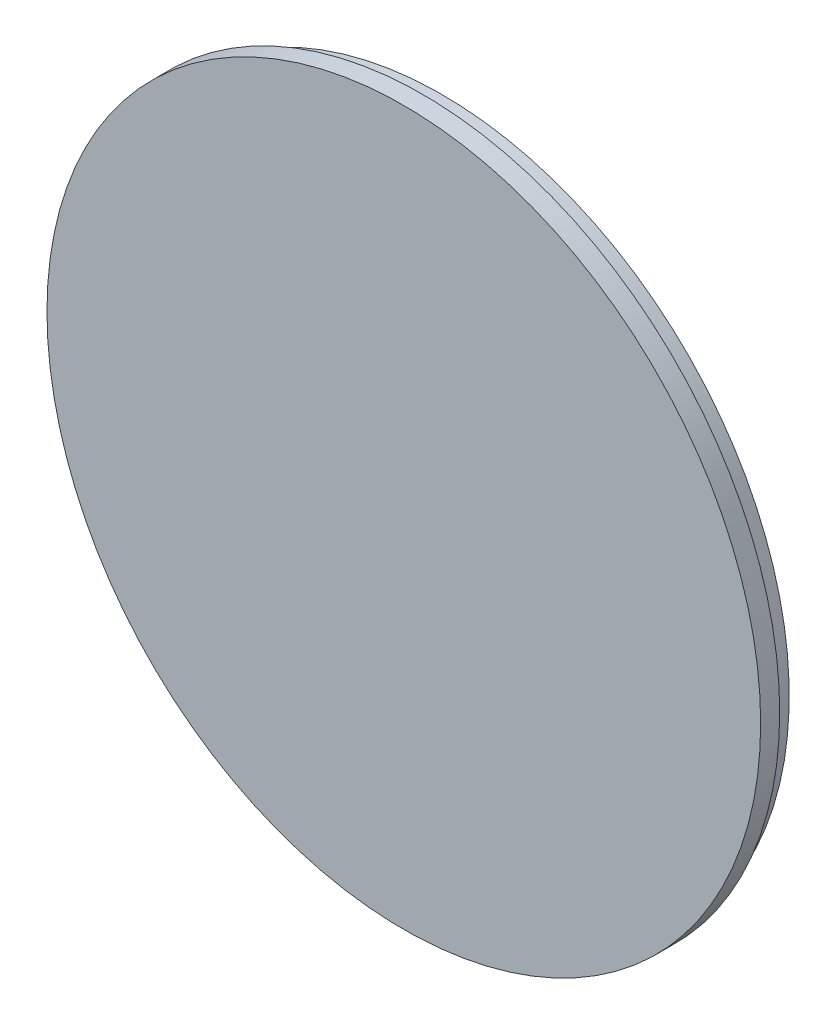
from build123d import *

# Parameters (mm, degrees)
SKETCH1_R           = 18.75
BOSS_EXTRUDE1_DEPTH = 1
SKETCH2_R           = 18.25
BOSS_EXTRUDE2_DEPTH = 1


with BuildPart() as part:
    # Sketch1 → Boss-Extrude1 (new body)
    with BuildSketch(Plane.XY):
        Circle(SKETCH1_R)
    extrude(amount=BOSS_EXTRUDE1_DEPTH)

    # Sketch2 → Boss-Extrude2 (add)
    with BuildSketch(Plane(origin=(0, 0, 0), x_dir=(-1, 0, 0), z_dir=(0, 0, -1))):
        Circle(SKETCH2_R)
    extrude(amount=BOSS_EXTRUDE2_DEPTH)


solid = part.part
